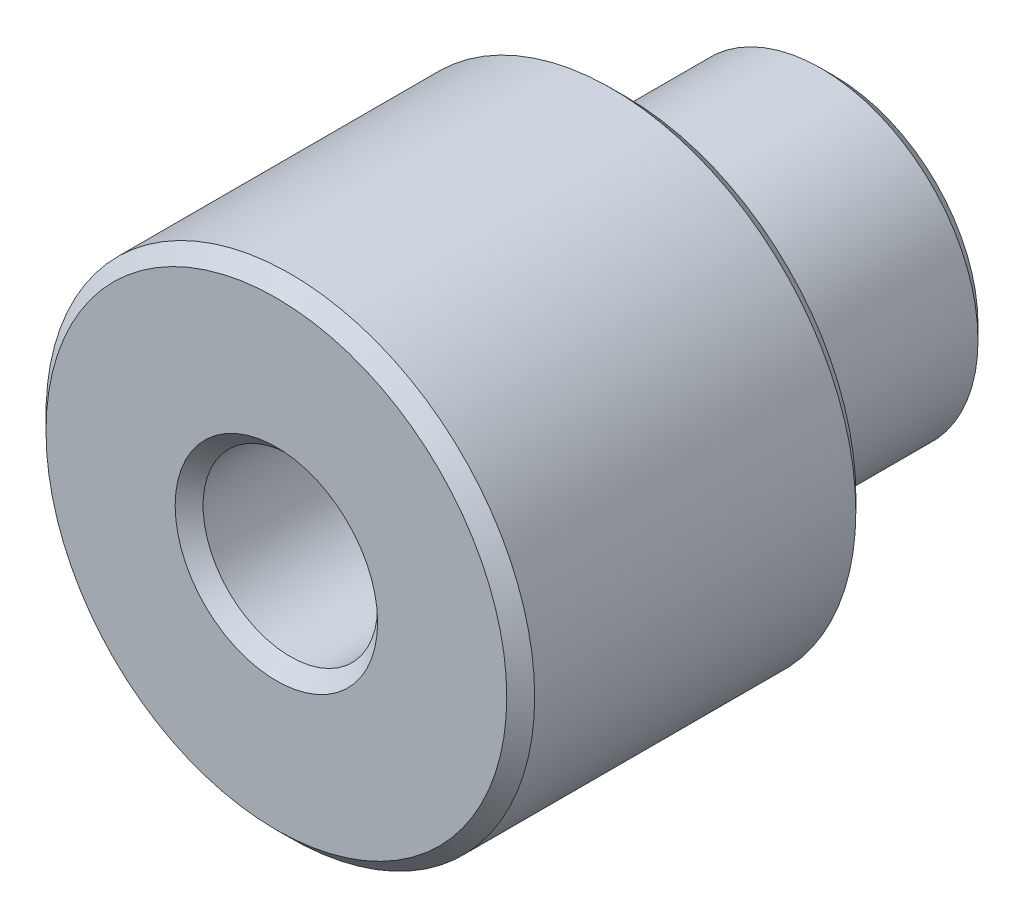
from build123d import *

# Parameters (mm, degrees)
SKETCH_1_R          = 3.5
EXTRUDE_1_DEPTH     = 5
SKETCH_2_R          = 2.25
EXTRUDE_2_DEPTH     = 3
CHAMFER_1_SIZE      = 0.2
SKETCH_4_R          = 1.25
CUT_EXTRUDE_1_DEPTH = 9
CHAMFER_2_SIZE      = 0.2


with BuildPart() as part:
    # Эскиз1 → Бобышка-Вытянуть1 (new body)
    with BuildSketch(Plane.XY):
        Circle(SKETCH_1_R)
    extrude(amount=EXTRUDE_1_DEPTH)

    # Эскиз2 → Бобышка-Вытянуть2 (add)
    with BuildSketch(Plane(origin=(0, 0, 0), x_dir=(-1, 0, 0), z_dir=(0, 0, -1))):
        with Locations(Location((0, 0, 0), (0, 0, 180))):
            Circle(SKETCH_2_R)
    extrude(amount=EXTRUDE_2_DEPTH)

    # Фаска1
    chamfer_1_edges = [part.edges().sort_by_distance(p)[0] for p in [
        (-3.5, 0, 0),
        (-3.5, 0, 5),
        (-2.25, 0, -3),
    ]]
    chamfer(chamfer_1_edges, length=CHAMFER_1_SIZE)

    # Эскиз4 → Вырез-Вытянуть1 (cut)
    with BuildSketch(Plane.XY.offset(5)):
        Circle(SKETCH_4_R)
    extrude(amount=-CUT_EXTRUDE_1_DEPTH, mode=Mode.SUBTRACT)

    # Фаска2
    chamfer_2_edges = [part.edges().sort_by_distance(p)[0] for p in [
        (-1.25, 0, -3),
        (-1.25, 0, 5),
    ]]
    chamfer(chamfer_2_edges, length=CHAMFER_2_SIZE)


solid = part.part
